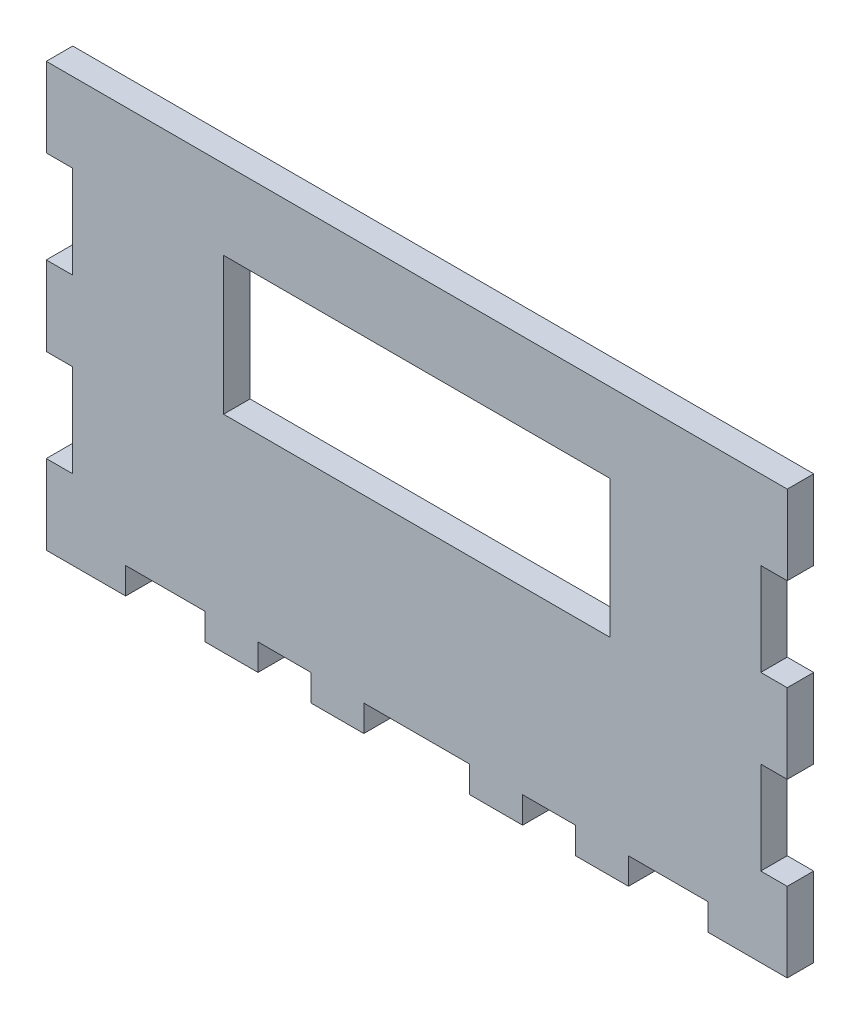
from build123d import *

# Parameters (mm, degrees)
SKETCH1_W           = 73
SKETCH1_H           = 26
BOSS_EXTRUDE1_DEPTH = 5


with BuildPart() as part:
    # Sketch1 → Boss-Extrude1 (new body)
    with BuildSketch(Plane.XY):
        Polygon((64.038630962, -4.683293815), (69.038630962, -4.683293815), (69.038630962, 10.316706185), (64.038630962, 10.316706185), (64.038630962, 27.816706185), (69.044687612, 27.816706185), (69.044687612, 42.816706185), (-70.955312388, 42.816706185), (-70.955312388, 27.816706185), (-65.955312388, 27.816706185), (-65.955312388, 10.316706185), (-70.955312388, 10.316706185), (-70.955312388, -4.683293815), (-65.955312388, -4.683293815), (-65.955312388, -22.183293815), (-70.955312388, -22.183293815), (-70.955312388, -37.183293815), (-55.955312388, -37.183293815), (-55.955312388, -32.183293815), (-40.955312388, -32.183293815), (-40.955312388, -37.183293815), (-30.955312388, -37.183293815), (-30.955312388, -32.183293815), (-20.955312388, -32.183293815), (-20.955312388, -37.183293815), (-10.955312388, -37.183293815), (-10.955312388, -32.183293815), (-0.955312388, -32.183293815), (9.044687612, -32.183293815), (9.044687612, -37.183293815), (19.044687612, -37.183293815), (19.044687612, -32.183293815), (29.044687612, -32.183293815), (29.044687612, -37.183293815), (39.038630962, -37.183293815), (39.038630962, -32.183293815), (39.044687612, -32.183293815), (54.038630962, -32.183293815), (54.038630962, -37.183293815), (69.038630962, -37.183293815), (69.038630962, -22.183293815), (64.038630962, -22.183293815), align=None)
        with Locations((-0.955312388, 14.816706185)):
            Rectangle(SKETCH1_W, SKETCH1_H, mode=Mode.SUBTRACT)
    extrude(amount=BOSS_EXTRUDE1_DEPTH)


solid = part.part
